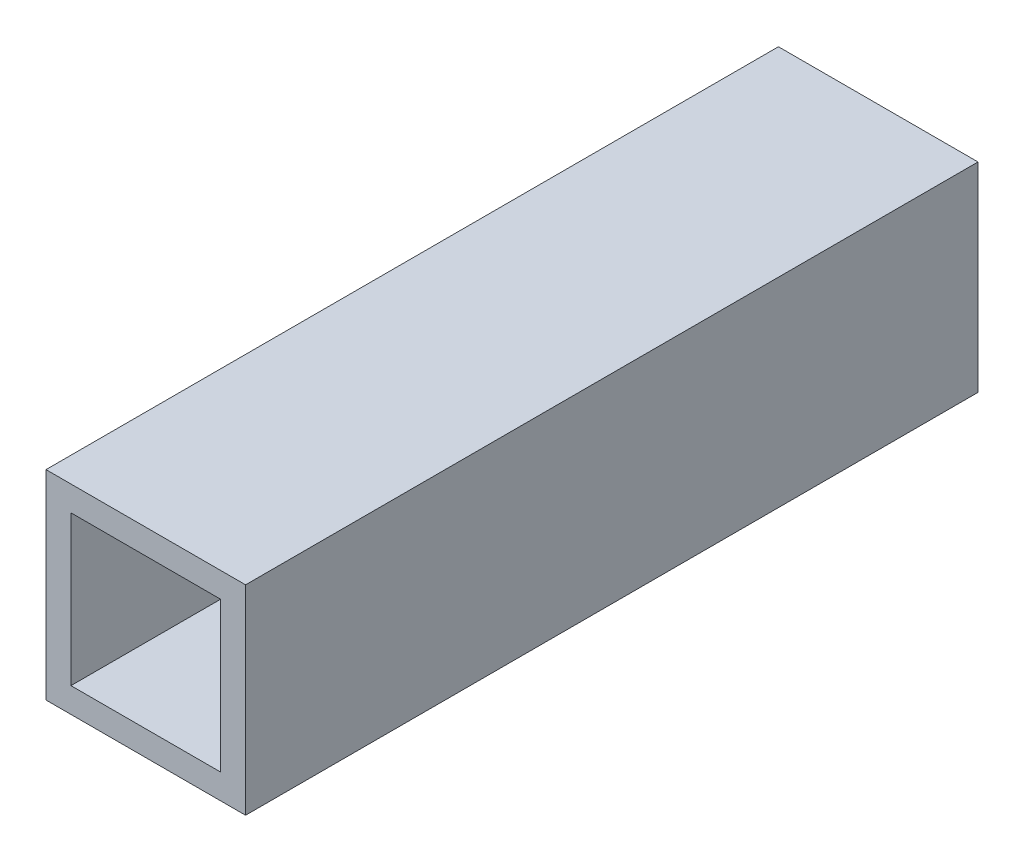
from build123d import *

# Parameters (mm, degrees)
SKETCH1_W           = 25.4
SKETCH1_H           = 25.4
SKETCH1_W_2         = 19.05
SKETCH1_H_2         = 19.05
BOSS_EXTRUDE1_DEPTH = 93.218


with BuildPart() as part:
    # Sketch1 → Boss-Extrude1 (new body)
    with BuildSketch(Plane.XY):
        Rectangle(SKETCH1_W, SKETCH1_H)
        Rectangle(SKETCH1_W_2, SKETCH1_H_2, mode=Mode.SUBTRACT)
    extrude(amount=BOSS_EXTRUDE1_DEPTH)


solid = part.part
